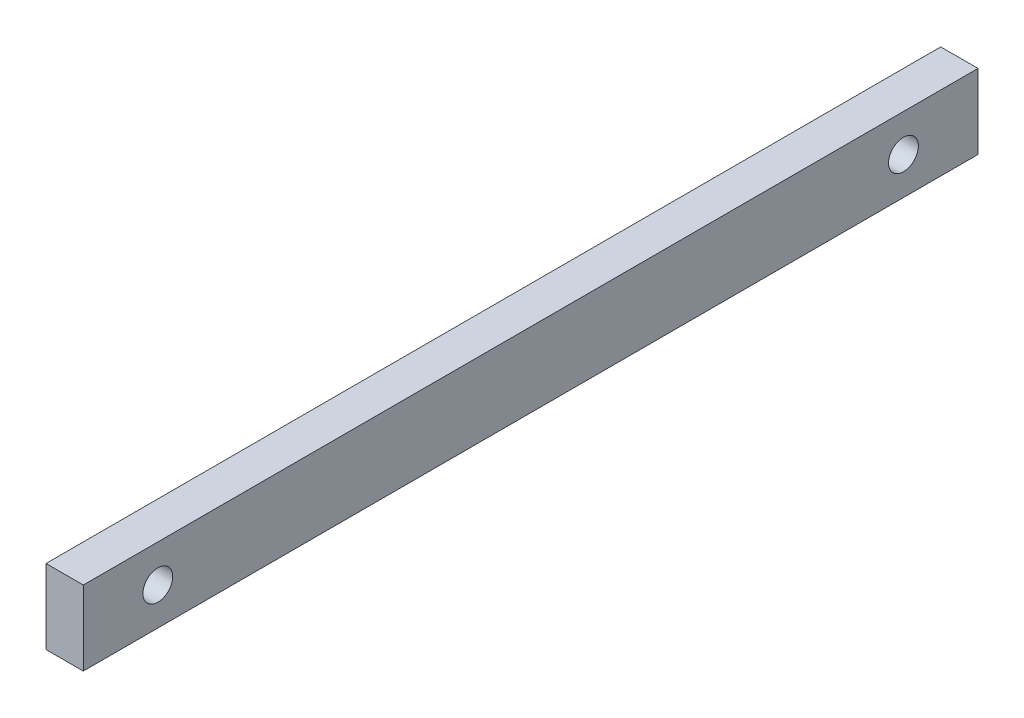
from build123d import *

# Parameters (mm, degrees)
SKETCH_2_W      = 120
SKETCH_2_H      = 10
SKETCH_2_R      = 2
EXTRUDE_1_DEPTH = 5


with BuildPart() as part:
    # 草图2 → 凸台-拉伸1 (new body)
    with BuildSketch(Plane(origin=(0, 0, 0), x_dir=(0, 0, -1), z_dir=(1, 0, 0))):
        Rectangle(SKETCH_2_W, SKETCH_2_H)
        with Locations((-50, 0)):
            Circle(SKETCH_2_R, mode=Mode.SUBTRACT)
        with Locations((50, 0)):
            Circle(SKETCH_2_R, mode=Mode.SUBTRACT)
    extrude(amount=EXTRUDE_1_DEPTH)


solid = part.part
